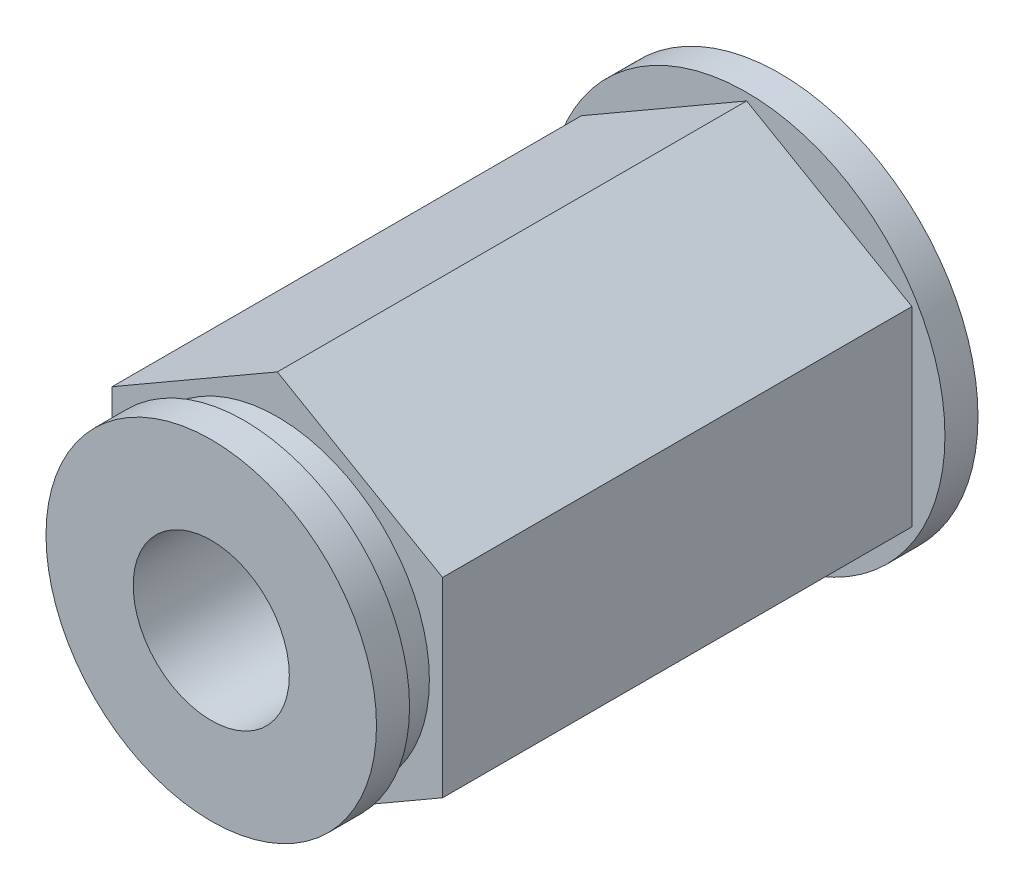
from build123d import *

# Parameters (mm, degrees)
BOSS_EXTRU_1_DEPTH      = 19.304
ESQUISSE2_R             = 7.62
BOSS_EXTRU_2_DEPTH      = 1.27
ESQUISSE3_R             = 5.842
BOSS_EXTRU_3_DEPTH      = 1.27
ESQUISSE4_R             = 6.35
BOSS_EXTRU_4_DEPTH      = 1.27
ESQUISSE5_R             = 3
ENL_V_MAT_EXTRU_1_DEPTH = 25.357527297


with BuildPart() as part:
    # Esquisse1 → Boss.-Extru.1 (new body)
    with BuildSketch(Plane.XY):
        Polygon((0, 7.332348419), (-6.35, 3.666174209), (-6.35, -3.666174209), (0, -7.332348419), (6.35, -3.666174209), (6.35, 3.666174209), align=None)
    extrude(amount=BOSS_EXTRU_1_DEPTH)

    # Esquisse2 → Boss.-Extru.2 (add)
    with BuildSketch(Plane.XY):
        Circle(ESQUISSE2_R)
    extrude(amount=BOSS_EXTRU_2_DEPTH)

    # Esquisse3 → Boss.-Extru.3 (add)
    with BuildSketch(Plane.XY.offset(19.304)):
        Circle(ESQUISSE3_R)
    extrude(amount=BOSS_EXTRU_3_DEPTH)

    # Esquisse4 → Boss.-Extru.4 (add)
    with BuildSketch(Plane.XY.offset(20.574)):
        with Locations(Location((0, 0, 0), (0, 0, 180))):
            Circle(ESQUISSE4_R)
    extrude(amount=BOSS_EXTRU_4_DEPTH)

    # Esquisse5 → Enlèv. mat.-Extru.1 (cut, through all)
    with BuildSketch(Plane.XY):
        Circle(ESQUISSE5_R)
    extrude(amount=ENL_V_MAT_EXTRU_1_DEPTH, mode=Mode.SUBTRACT)


solid = part.part
